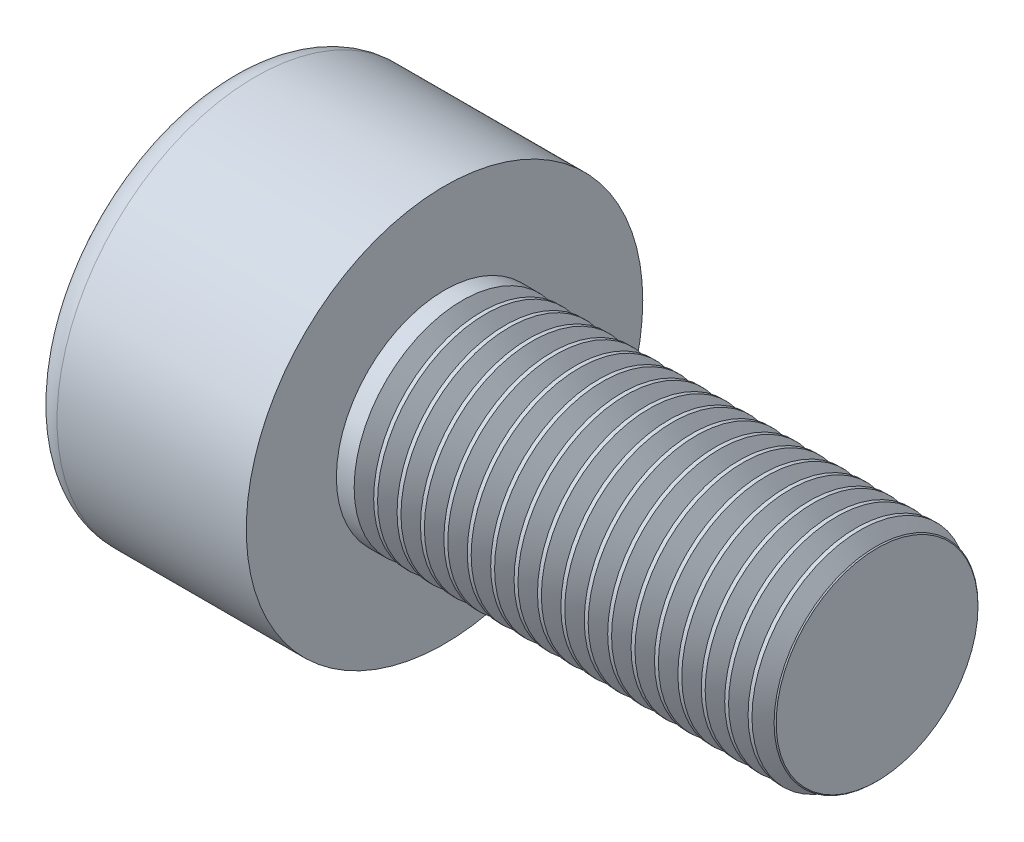
from build123d import *

# Parameters (mm, degrees)
SKETCH1_R           = 2.75
BASEHEAD_DEPTH      = 3
SKETCH2_R           = 1.5
BASEBODY_DEPTH      = 6
HEXAGONSOCKET_DEPTH = 1.3
TOPFILLET_R         = 0.375
CHAMFER1_SIZE       = 0.1
LPATTERN10_COUNT    = 18
LPATTERN10_PITCH    = 0.3246


with BuildPart() as part:
    # Sketch1 → BaseHead (new body)
    with BuildSketch(Plane(origin=(0, 0, 0), x_dir=(0, 0, -1), z_dir=(1, 0, 0))):
        Circle(SKETCH1_R)
    extrude(amount=BASEHEAD_DEPTH)

    # Sketch2 → BaseBody (add)
    with BuildSketch(Plane(origin=(3, 0, 0), x_dir=(0, 0, -1), z_dir=(1, 0, 0))):
        Circle(SKETCH2_R)
    extrude(amount=BASEBODY_DEPTH)

    # Sketch3 → HexagonSocket (cut)
    with BuildSketch(Plane(origin=(0, 0, 0), x_dir=(0, 0, -1), z_dir=(1, 0, 0))):
        Polygon((1.443375673, 0), (0.721687836, 1.25), (-0.721687836, 1.25), (-1.443375673, 0), (-0.721687836, -1.25), (0.721687836, -1.25), align=None)
    extrude(amount=HEXAGONSOCKET_DEPTH, mode=Mode.SUBTRACT)

    # Sketch4 → Cut-Revolve1 (revolve, cut)
    with BuildSketch(Plane(origin=(-4.19613823, 0.75, 0), x_dir=(-1, 0, 0), z_dir=(0, 0, 1)), mode=Mode.PRIVATE) as cut_revolve1_sk:
        Polygon((-5.49613823, 2), (-6.217826066, 0.75), (-5.49613823, 0.75), align=None)
    revolve(cut_revolve1_sk.sketch.rotate(Axis((0.838992387, 0, 0), (-1, 0, 0)), 90), axis=Axis((0.838992387, 0, 0), (-1, 0, 0)), mode=Mode.SUBTRACT)

    # TopFillet
    topfillet_edges = [part.edges().sort_by_distance(p)[0] for p in [
        (0, 0, 2.75),
    ]]
    fillet(topfillet_edges, radius=TOPFILLET_R)

    # Chamfer1
    chamfer1_edges = [part.edges().sort_by_distance(p)[0] for p in [
        (9, 0, 1.5),
    ]]
    chamfer(chamfer1_edges, length=CHAMFER1_SIZE)

    # Sketch5 → Cut-Revolve10 (revolve, cut)
    with BuildSketch(Plane.XY, mode=Mode.PRIVATE) as cut_revolve10_sk:
        Polygon((8.9, 1.265740128), (9.03525, 1.5), (9.03525, 1.7705), (8.76475, 1.7705), (8.76475, 1.5), align=None)
    cut_revolve10 = revolve(cut_revolve10_sk.sketch.rotate(Axis((0, 0, 0), (1, 0, 0)), 90), axis=Axis((0, 0, 0), (1, 0, 0)), mode=Mode.SUBTRACT)

    # LPattern10: Cut-Revolve10 ×18
    with Locations(*[(-i * LPATTERN10_PITCH, 0, 0) for i in range(1, LPATTERN10_COUNT)]):
        add(cut_revolve10, mode=Mode.SUBTRACT)


solid = part.part
